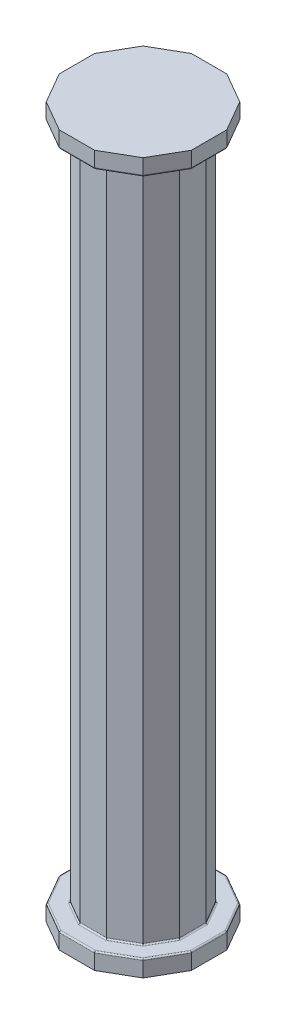
from build123d import *

# Parameters (mm, degrees)
SUPPORT_BASE_DEPTH   = 6248.4
BOTTOM_EXTRUDE_DEPTH = 152.4
FACE_FILLET_R        = 12.7


with BuildPart() as part:
    # Sketch1 → Support Base (new body)
    with BuildSketch(Plane(origin=(0, 0, 0), x_dir=(1, 0, 0), z_dir=(0, 1, 0))):
        Polygon((-122.50637078, 457.2), (-334.69362922, 334.69362922), (-457.2, 122.50637078), (-457.2, -122.50637078), (-334.69362922, -334.69362922), (-122.50637078, -457.2), (122.50637078, -457.2), (334.69362922, -334.69362922), (457.2, -122.50637078), (457.2, 122.50637078), (334.69362922, 334.69362922), (122.50637078, 457.2), align=None)
    extrude(amount=SUPPORT_BASE_DEPTH)

    # Sketch2 → Bottom Extrude (add)
    with BuildSketch(Plane.XZ):
        Polygon((-163.341827706, -609.6), (163.341827706, -609.6), (446.258172294, -446.258172294), (609.6, -163.341827706), (609.6, 163.341827706), (446.258172294, 446.258172294), (163.341827706, 609.6), (-163.341827706, 609.6), (-446.258172294, 446.258172294), (-609.6, 163.341827706), (-609.6, -163.341827706), (-446.258172294, -446.258172294), align=None)
    bottom_extrude = extrude(amount=BOTTOM_EXTRUDE_DEPTH)

    # Top Extrude: Bottom Extrude across plane
    add(bottom_extrude.mirror(Plane.ZX.offset(3124.2)))

    # Face Fillet
    face_fillet_edges = [part.edges().sort_by_distance(p)[0] for p in [
        (-395.94681461, 6248.4, -228.6),
        (228.6, 0, -395.94681461),
        (395.94681461, 0, -228.6),
        (457.2, 0, 0),
        (395.94681461, 0, 228.6),
        (228.6, 0, 395.94681461),
        (0, 0, 457.2),
        (-457.2, 6248.4, 0),
        (-228.6, 0, 395.94681461),
        (-395.94681461, 0, 228.6),
        (-457.2, 0, 0),
        (-395.94681461, 0, -228.6),
        (-228.6, 0, -395.94681461),
        (0, 0, -457.2),
        (-395.94681461, 6248.4, 228.6),
        (-228.6, 6248.4, 395.94681461),
        (0, 6248.4, 457.2),
        (228.6, 6248.4, 395.94681461),
        (395.94681461, 6248.4, 228.6),
        (457.2, 6248.4, 0),
        (395.94681461, 6248.4, -228.6),
        (-304.8, 0, -527.929086147),
        (0, 0, -609.6),
        (304.8, 0, -527.929086147),
        (527.929086147, 0, -304.8),
        (228.6, 6248.4, -395.94681461),
        (609.6, 0, 0),
        (527.929086147, 0, 304.8),
        (304.8, 0, 527.929086147),
        (0, 0, 609.6),
        (-304.8, 0, 527.929086147),
        (-527.929086147, 0, 304.8),
        (-609.6, 0, 0),
        (0, 6248.4, -457.2),
        (-527.929086147, 0, -304.8),
        (-304.8, 6248.4, -527.929086147),
        (0, 6248.4, -609.6),
        (304.8, 6248.4, -527.929086147),
        (527.929086147, 6248.4, -304.8),
        (609.6, 6248.4, 0),
        (527.929086147, 6248.4, 304.8),
        (304.8, 6248.4, 527.929086147),
        (0, 6248.4, 609.6),
        (-304.8, 6248.4, 527.929086147),
        (-527.929086147, 6248.4, 304.8),
        (-609.6, 6248.4, 0),
        (-228.6, 6248.4, -395.94681461),
        (-527.929086147, 6248.4, -304.8),
    ]]
    fillet(face_fillet_edges, radius=FACE_FILLET_R)


solid = part.part
